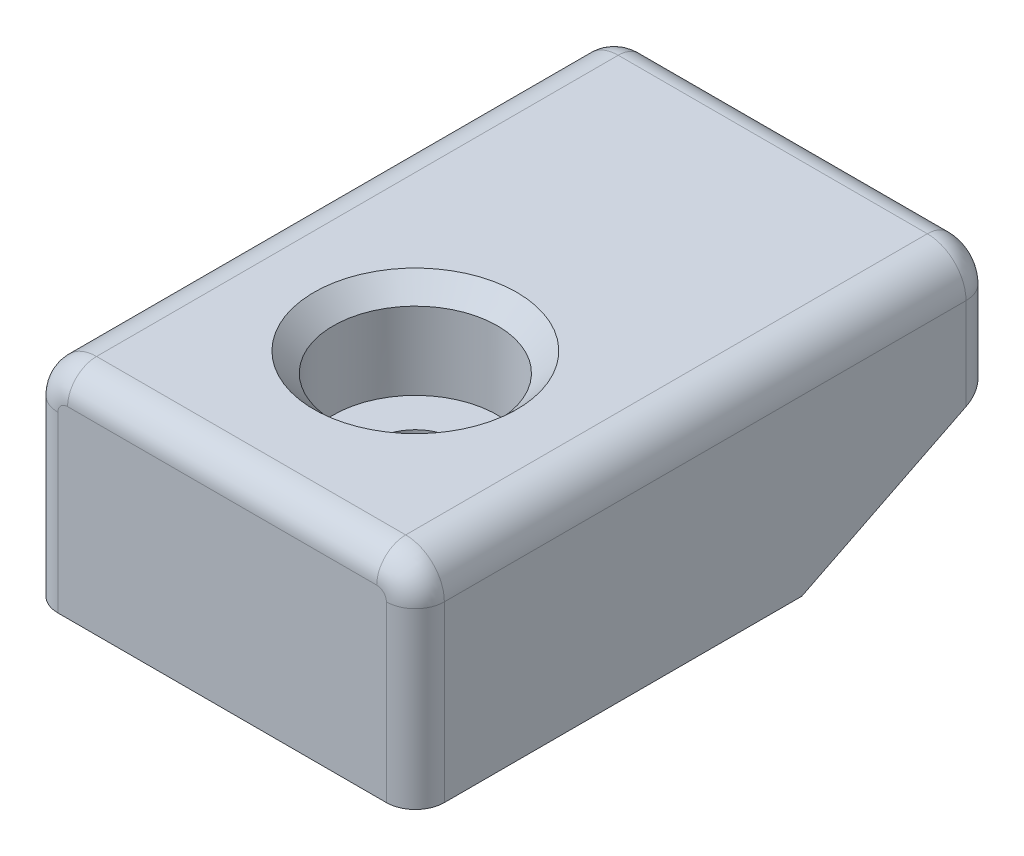
from build123d import *

# Parameters (mm, degrees)
SKETCH1_W           = 40
SKETCH1_H           = 60
SKETCH1_R           = 4.15
BOSS_EXTRUDE1_DEPTH = 11
SKETCH2_R           = 8.5
CUT_EXTRUDE1_DEPTH  = 10
FILLET1_R           = 4
CHAMFER1_SIZE       = 2
CHAMFER2_SIZE       = 20
CHAMFER2_SIZE2      = 10
FILLET2_R           = 3


with BuildPart() as part:
    # Sketch1 → Boss-Extrude1 (new, symmetric)
    with BuildSketch(Plane(origin=(0, 0, 0), x_dir=(1, 0, 0), z_dir=(0, 1, 0))):
        with Locations((0, 0.089127558)):
            Rectangle(SKETCH1_W, SKETCH1_H)
        with Locations(Location((0, -9.910872442, 0), (0, 0, 270))):
            Circle(SKETCH1_R, mode=Mode.SUBTRACT)
    extrude(amount=BOSS_EXTRUDE1_DEPTH, both=True)

    # Sketch2 → Cut-Extrude1 (cut)
    with BuildSketch(Plane(origin=(0, 11, 0), x_dir=(1, 0, 0), z_dir=(0, 1, 0))):
        with Locations(Location((0, -9.910872442, 0), (0, 0, 270))):
            Circle(SKETCH2_R)
    extrude(amount=-CUT_EXTRUDE1_DEPTH, mode=Mode.SUBTRACT)

    # Fillet1
    fillet1_edges = [part.edges().sort_by_distance(p)[0] for p in [
        (-20, 11, -0.089127558),
        (20, 11, -0.089127558),
    ]]
    fillet(fillet1_edges, radius=FILLET1_R)

    # Chamfer1
    chamfer1_edges = [part.edges().sort_by_distance(p)[0] for p in [
        (0, 11, 1.410872442),
    ]]
    chamfer(chamfer1_edges, length=CHAMFER1_SIZE)

    # Chamfer2
    chamfer2_edges = [part.edges().sort_by_distance(p)[0] for p in [
        (0, -11, -30.089127558),
    ]]
    chamfer2_side = [part.faces().sort_by_distance(p)[0] for p in [
        (0, -11, -0.319769187),
    ]]
    chamfer(chamfer2_edges, length=CHAMFER2_SIZE, length2=CHAMFER2_SIZE2, reference=chamfer2_side[0])

    # Fillet2
    fillet2_edges = [part.edges().sort_by_distance(p)[0] for p in [
        (0, 11, -30.089127558),
        (0, 11, 29.910872442),
        (20, -2, 29.910872442),
        (-20, -2, 29.910872442),
        (18.828427125, 9.828427125, 29.910872442),
        (-18.828427125, 9.828427125, 29.910872442),
        (-20, 3, -30.089127558),
        (20, 3, -30.089127558),
        (18.828427125, 9.828427125, -30.089127558),
        (-18.828427125, 9.828427125, -30.089127558),
    ]]
    fillet(fillet2_edges, radius=FILLET2_R)


solid = part.part
